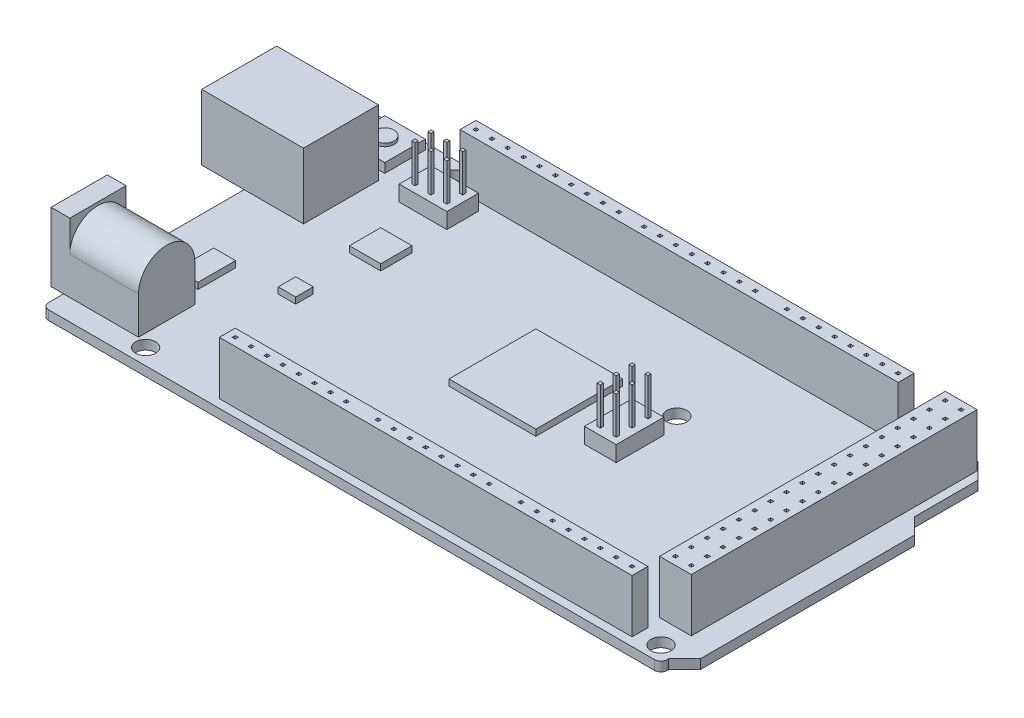
from build123d import *

# Parameters (mm, degrees)
BOSS_EXTRUDE1_DEPTH      = 1.5
FILLET1_R                = 1
SKETCH2_R                = 1.6
CUT_EXTRUDE1_DEPTH       = 59.477289609
SKETCH3_W                = 5.08
SKETCH3_H                = 45.72
BOSS_EXTRUDE2_DEPTH      = 8.5
SKETCH4_W                = 0.5
SKETCH4_H                = 0.5
CUT_EXTRUDE2_DEPTH       = 7
BOSS_EXTRUDE3_DEPTH      = 6.8
BOSS_EXTRUDE3_DEPTH_BACK = 9.5
SKETCH5_W                = 12
SKETCH5_H                = 10.5
BOSS_EXTRUDE4_DEPTH      = 2
BOSS_EXTRUDE4_DEPTH_BACK = 1
SKETCH6_W                = 9
SKETCH6_H                = 11
SKETCH7_R                = 4.5
BOSS_EXTRUDE5_DEPTH      = 11
SKETCH8_W                = 11
SKETCH8_H                = 9
BOSS_EXTRUDE6_DEPTH      = 6
CUT_EXTRUDE3_DEPTH       = 9
SKETCH10_W               = 5
SKETCH10_H               = 3.5
BOSS_EXTRUDE7_DEPTH      = 8.5
SKETCH11_W               = 13.9
SKETCH11_H               = 13.9
SKETCH11_W_2             = 5
SKETCH11_H_2             = 5
SKETCH11_W_3             = 2.8
SKETCH11_H_3             = 2.8
SKETCH11_W_4             = 3.5
SKETCH11_H_4             = 6
BOSS_EXTRUDE8_DEPTH      = 1
SKETCH12_R               = 3
CUT_EXTRUDE4_DEPTH       = 9.5
SKETCH13_R               = 1.25
BOSS_EXTRUDE9_DEPTH      = 7.5
FILLET2_R                = 1
SKETCH14_W               = 6.5
SKETCH14_H               = 6.5
BOSS_EXTRUDE10_DEPTH     = 1.5
SKETCH15_R               = 1.5
BOSS_EXTRUDE11_DEPTH     = 0.5
SKETCH16_W               = 5.08
SKETCH16_H               = 7.62
SKETCH16_W_2             = 7.62
SKETCH16_H_2             = 5.08
BOSS_EXTRUDE12_DEPTH     = 2.5
SKETCH17_W               = 0.5
SKETCH17_H               = 0.5
BOSS_EXTRUDE13_DEPTH     = 6


with BuildPart() as part:
    # Sketch1 → Boss-Extrude1 (new body)
    with BuildSketch(Plane(origin=(0, 0, 0), x_dir=(1, 0, 0), z_dir=(0, 1, 0))):
        Polygon((49.49, 24.11), (49.49, 13.95), (52.03, 11.41), (52.03, -22.85), (49.49, -25.39), (49.49, -26.65), (-49.49, -26.65), (-49.49, 26.65), (46.95, 26.65), align=None)
    extrude(amount=BOSS_EXTRUDE1_DEPTH)

    # Fillet1
    fillet1_edges = [part.edges().sort_by_distance(p)[0] for p in [
        (-49.49, 0.75, -26.65),
        (49.49, 0.75, 26.65),
        (-49.49, 0.75, 26.65),
    ]]
    fillet(fillet1_edges, radius=FILLET1_R)

    # Sketch2 → Cut-Extrude1 (cut, through all)
    with BuildSketch(Plane(origin=(0, 1.5, 0), x_dir=(1, 0, 0), z_dir=(0, 1, 0))):
        with Locations(Location((46.98, -24.11, 0), (0, 0, 270))):
            Circle(SKETCH2_R)
        with Locations(Location((40.62, 24.11, 0), (0, 0, 270))):
            Circle(SKETCH2_R)
        with Locations(Location((-34.26, 24.11, 0), (0, 0, 270))):
            Circle(SKETCH2_R)
        with Locations(Location((-35.49, -24.11, 0), (0, 0, 270))):
            Circle(SKETCH2_R)
        with Locations(Location((16.53, -19.03, 0), (0, 0, 270))):
            Circle(SKETCH2_R)
        with Locations(Location((16.53, 8.88, 0), (0, 0, 270))):
            Circle(SKETCH2_R)
    extrude(amount=-CUT_EXTRUDE1_DEPTH, mode=Mode.SUBTRACT)

    # Sketch3 → Boss-Extrude2 (add)
    with BuildSketch(Plane(origin=(0, 1.5, 0), x_dir=(1, 0, 0), z_dir=(0, 1, 0))):
        Polygon((-22.51, -22.76), (-2.19, -22.76), (0.35, -22.76), (20.67, -22.76), (23.21, -22.76), (43.53, -22.76), (43.53, -25.3), (23.21, -25.3), (20.67, -25.3), (0.35, -25.3), (-2.19, -25.3), (-22.51, -25.3), align=None)
        with Locations((45.6, 2.44)):
            Rectangle(SKETCH3_W, SKETCH3_H)
        Polygon((38.06, 25.3), (17.74, 25.3), (15.2, 25.3), (-5.12, 25.3), (-6.64, 25.3), (-32.04, 25.3), (-32.04, 22.76), (-6.64, 22.76), (-5.12, 22.76), (15.2, 22.76), (17.74, 22.76), (38.06, 22.76), align=None)
    extrude(amount=BOSS_EXTRUDE2_DEPTH)

    # Sketch4 → Cut-Extrude2 (cut)
    with BuildSketch(Plane(origin=(0, 10, 0), x_dir=(1, 0, 0), z_dir=(0, 1, 0))):
        with Locations((-21.24, -24.03)):
            Rectangle(SKETCH4_W, SKETCH4_H)
        with Locations((-18.7, -24.03)):
            Rectangle(SKETCH4_W, SKETCH4_H)
        with Locations((-16.16, -24.03)):
            Rectangle(SKETCH4_W, SKETCH4_H)
        with Locations((-13.62, -24.03)):
            Rectangle(SKETCH4_W, SKETCH4_H)
        with Locations((-11.08, -24.03)):
            Rectangle(SKETCH4_W, SKETCH4_H)
        with Locations((-8.54, -24.03)):
            Rectangle(SKETCH4_W, SKETCH4_H)
        with Locations((-6, -24.03)):
            Rectangle(SKETCH4_W, SKETCH4_H)
        with Locations((-3.46, -24.03)):
            Rectangle(SKETCH4_W, SKETCH4_H)
        with Locations((1.62, -24.03)):
            Rectangle(SKETCH4_W, SKETCH4_H)
        with Locations((4.16, -24.03)):
            Rectangle(SKETCH4_W, SKETCH4_H)
        with Locations((6.7, -24.03)):
            Rectangle(SKETCH4_W, SKETCH4_H)
        with Locations((9.24, -24.03)):
            Rectangle(SKETCH4_W, SKETCH4_H)
        with Locations((11.78, -24.03)):
            Rectangle(SKETCH4_W, SKETCH4_H)
        with Locations((14.32, -24.03)):
            Rectangle(SKETCH4_W, SKETCH4_H)
        with Locations((16.86, -24.03)):
            Rectangle(SKETCH4_W, SKETCH4_H)
        with Locations((19.4, -24.03)):
            Rectangle(SKETCH4_W, SKETCH4_H)
        with Locations((24.48, -24.03)):
            Rectangle(SKETCH4_W, SKETCH4_H)
        with Locations((27.02, -24.03)):
            Rectangle(SKETCH4_W, SKETCH4_H)
        with Locations((29.56, -24.03)):
            Rectangle(SKETCH4_W, SKETCH4_H)
        with Locations((32.1, -24.03)):
            Rectangle(SKETCH4_W, SKETCH4_H)
        with Locations((34.64, -24.03)):
            Rectangle(SKETCH4_W, SKETCH4_H)
        with Locations((37.18, -24.03)):
            Rectangle(SKETCH4_W, SKETCH4_H)
        with Locations((39.72, -24.03)):
            Rectangle(SKETCH4_W, SKETCH4_H)
        with Locations((42.26, -24.03)):
            Rectangle(SKETCH4_W, SKETCH4_H)
        with Locations((46.87, -19.15)):
            Rectangle(SKETCH4_W, SKETCH4_H)
        with Locations((44.33, -19.15)):
            Rectangle(SKETCH4_W, SKETCH4_H)
        with Locations((46.87, -16.61)):
            Rectangle(SKETCH4_W, SKETCH4_H)
        with Locations((44.33, -16.61)):
            Rectangle(SKETCH4_W, SKETCH4_H)
        with Locations((46.87, -14.07)):
            Rectangle(SKETCH4_W, SKETCH4_H)
        with Locations((44.33, -14.07)):
            Rectangle(SKETCH4_W, SKETCH4_H)
        with Locations((46.87, -11.53)):
            Rectangle(SKETCH4_W, SKETCH4_H)
        with Locations((44.33, -11.53)):
            Rectangle(SKETCH4_W, SKETCH4_H)
        with Locations((46.87, -8.99)):
            Rectangle(SKETCH4_W, SKETCH4_H)
        with Locations((44.33, -8.99)):
            Rectangle(SKETCH4_W, SKETCH4_H)
        with Locations((46.87, -6.45)):
            Rectangle(SKETCH4_W, SKETCH4_H)
        with Locations((44.33, -6.45)):
            Rectangle(SKETCH4_W, SKETCH4_H)
        with Locations((46.87, -3.91)):
            Rectangle(SKETCH4_W, SKETCH4_H)
        with Locations((44.33, -3.91)):
            Rectangle(SKETCH4_W, SKETCH4_H)
        with Locations((46.87, -1.37)):
            Rectangle(SKETCH4_W, SKETCH4_H)
        with Locations((44.33, -1.37)):
            Rectangle(SKETCH4_W, SKETCH4_H)
        with Locations((46.87, 1.17)):
            Rectangle(SKETCH4_W, SKETCH4_H)
        with Locations((44.33, 1.17)):
            Rectangle(SKETCH4_W, SKETCH4_H)
        with Locations((46.87, 3.71)):
            Rectangle(SKETCH4_W, SKETCH4_H)
        with Locations((44.33, 3.71)):
            Rectangle(SKETCH4_W, SKETCH4_H)
        with Locations((46.87, 6.25)):
            Rectangle(SKETCH4_W, SKETCH4_H)
        with Locations((44.33, 6.25)):
            Rectangle(SKETCH4_W, SKETCH4_H)
        with Locations((46.87, 8.79)):
            Rectangle(SKETCH4_W, SKETCH4_H)
        with Locations((44.33, 8.79)):
            Rectangle(SKETCH4_W, SKETCH4_H)
        with Locations((46.87, 11.33)):
            Rectangle(SKETCH4_W, SKETCH4_H)
        with Locations((44.33, 11.33)):
            Rectangle(SKETCH4_W, SKETCH4_H)
        with Locations((46.87, 13.87)):
            Rectangle(SKETCH4_W, SKETCH4_H)
        with Locations((44.33, 13.87)):
            Rectangle(SKETCH4_W, SKETCH4_H)
        with Locations((46.87, 16.41)):
            Rectangle(SKETCH4_W, SKETCH4_H)
        with Locations((44.33, 16.41)):
            Rectangle(SKETCH4_W, SKETCH4_H)
        with Locations((46.87, 18.95)):
            Rectangle(SKETCH4_W, SKETCH4_H)
        with Locations((44.33, 18.95)):
            Rectangle(SKETCH4_W, SKETCH4_H)
        with Locations((46.87, 21.49)):
            Rectangle(SKETCH4_W, SKETCH4_H)
        with Locations((44.33, 21.49)):
            Rectangle(SKETCH4_W, SKETCH4_H)
        with Locations((46.87, 24.03)):
            Rectangle(SKETCH4_W, SKETCH4_H)
        with Locations((44.33, 24.03)):
            Rectangle(SKETCH4_W, SKETCH4_H)
        with Locations((36.79, 24.03)):
            Rectangle(SKETCH4_W, SKETCH4_H)
        with Locations((34.25, 24.03)):
            Rectangle(SKETCH4_W, SKETCH4_H)
        with Locations((31.71, 24.03)):
            Rectangle(SKETCH4_W, SKETCH4_H)
        with Locations((29.17, 24.03)):
            Rectangle(SKETCH4_W, SKETCH4_H)
        with Locations((26.63, 24.03)):
            Rectangle(SKETCH4_W, SKETCH4_H)
        with Locations((24.09, 24.03)):
            Rectangle(SKETCH4_W, SKETCH4_H)
        with Locations((21.55, 24.03)):
            Rectangle(SKETCH4_W, SKETCH4_H)
        with Locations((19.01, 24.03)):
            Rectangle(SKETCH4_W, SKETCH4_H)
        with Locations((13.93, 24.03)):
            Rectangle(SKETCH4_W, SKETCH4_H)
        with Locations((11.39, 24.03)):
            Rectangle(SKETCH4_W, SKETCH4_H)
        with Locations((8.85, 24.03)):
            Rectangle(SKETCH4_W, SKETCH4_H)
        with Locations((6.31, 24.03)):
            Rectangle(SKETCH4_W, SKETCH4_H)
        with Locations((3.77, 24.03)):
            Rectangle(SKETCH4_W, SKETCH4_H)
        with Locations((1.23, 24.03)):
            Rectangle(SKETCH4_W, SKETCH4_H)
        with Locations((-1.31, 24.03)):
            Rectangle(SKETCH4_W, SKETCH4_H)
        with Locations((-3.85, 24.03)):
            Rectangle(SKETCH4_W, SKETCH4_H)
        with Locations((-7.91, 24.03)):
            Rectangle(SKETCH4_W, SKETCH4_H)
        with Locations((-10.45, 24.03)):
            Rectangle(SKETCH4_W, SKETCH4_H)
        with Locations((-12.99, 24.03)):
            Rectangle(SKETCH4_W, SKETCH4_H)
        with Locations((-15.53, 24.03)):
            Rectangle(SKETCH4_W, SKETCH4_H)
        with Locations((-18.07, 24.03)):
            Rectangle(SKETCH4_W, SKETCH4_H)
        with Locations((-20.61, 24.03)):
            Rectangle(SKETCH4_W, SKETCH4_H)
        with Locations((-23.15, 24.03)):
            Rectangle(SKETCH4_W, SKETCH4_H)
        with Locations((-25.69, 24.03)):
            Rectangle(SKETCH4_W, SKETCH4_H)
        with Locations((-28.23, 24.03)):
            Rectangle(SKETCH4_W, SKETCH4_H)
        with Locations((-30.77, 24.03)):
            Rectangle(SKETCH4_W, SKETCH4_H)
    extrude(amount=-CUT_EXTRUDE2_DEPTH, mode=Mode.SUBTRACT)

    # Sketch5 → Boss-Extrude3 (add, two sides: drawn at the far end of the back side and taken through both)
    with BuildSketch(Plane.ZY.offset(49.49).offset(-BOSS_EXTRUDE3_DEPTH_BACK)):
        with Locations((-11.65, 6.75)):
            Rectangle(SKETCH5_W, SKETCH5_H)
    extrude(amount=BOSS_EXTRUDE3_DEPTH + BOSS_EXTRUDE3_DEPTH_BACK)



with BuildPart() as body_2:
    # Sketch6 → Boss-Extrude4 (new, two sides: drawn at the far end of the back side and taken through both)
    with BuildSketch(Plane.ZY.offset(49.49).offset(-BOSS_EXTRUDE4_DEPTH_BACK)):
        with Locations((18.75, 7)):
            Rectangle(SKETCH6_W, SKETCH6_H)
    extrude(amount=BOSS_EXTRUDE4_DEPTH + BOSS_EXTRUDE4_DEPTH_BACK)


with BuildPart() as part_1:
    add(part.part)

    add(body_2.part)  # Boss-Extrude5 merges body 2
    # Sketch7 → Boss-Extrude5 (add)
    with BuildSketch(Plane(origin=(-48.49, 0, 0), x_dir=(0, 0, -1), z_dir=(1, 0, 0))):
        with Locations((-18.75, 7.5)):
            Circle(SKETCH7_R)
    extrude(amount=BOSS_EXTRUDE5_DEPTH)

    # Sketch8 → Boss-Extrude6 (add)
    with BuildSketch(Plane(origin=(0, 1.5, 0), x_dir=(1, 0, 0), z_dir=(0, 1, 0))):
        with Locations((-42.99, -18.75)):
            Rectangle(SKETCH8_W, SKETCH8_H)
    extrude(amount=BOSS_EXTRUDE6_DEPTH)

    # Sketch9 → Cut-Extrude3 (cut)
    with BuildSketch(Plane.ZY.offset(56.29)):
        Polygon((-14.15, 10.5), (-9.15, 10.5), (-7.65, 9), (-7.65, 2.5), (-15.65, 2.5), (-15.65, 9), align=None)
    extrude(amount=-CUT_EXTRUDE3_DEPTH, mode=Mode.SUBTRACT)

    # Sketch10 → Boss-Extrude7 (add)
    with BuildSketch(Plane.ZY.offset(47.29)):
        with Locations((-11.65, 6.5)):
            Rectangle(SKETCH10_W, SKETCH10_H)
    extrude(amount=BOSS_EXTRUDE7_DEPTH)

    # Sketch11 → Boss-Extrude8 (add)
    with BuildSketch(Plane(origin=(0, 1.5, 0), x_dir=(1, 0, 0), z_dir=(0, 1, 0))):
        with Locations((1.09, 1.75)):
            Rectangle(SKETCH11_W, SKETCH11_H)
        with Locations((-29.79, 7.8)):
            Rectangle(SKETCH11_W_2, SKETCH11_H_2)
        with Locations((-30.89, -4.7)):
            Rectangle(SKETCH11_W_3, SKETCH11_H_3)
        with Locations((-41.090307387, -8.878300353)):
            Rectangle(SKETCH11_W_4, SKETCH11_H_4)
    extrude(amount=BOSS_EXTRUDE8_DEPTH)

    # Sketch12 → Cut-Extrude4 (cut)
    with BuildSketch(Plane.ZY.offset(51.49)):
        with Locations((18.75, 8)):
            Circle(SKETCH12_R)
    extrude(amount=-CUT_EXTRUDE4_DEPTH, mode=Mode.SUBTRACT)

    # Sketch13 → Boss-Extrude9 (add)
    with BuildSketch(Plane.ZY.offset(41.99)):
        with Locations((18.75, 8)):
            Circle(SKETCH13_R)
    extrude(amount=BOSS_EXTRUDE9_DEPTH)

    # Fillet2
    fillet2_edges = [part_1.edges().sort_by_distance(p)[0] for p in [
        (-49.49, 8, 17.5),
    ]]
    fillet(fillet2_edges, radius=FILLET2_R)

    # Sketch14 → Boss-Extrude10 (add)
    with BuildSketch(Plane(origin=(0, 1.5, 0), x_dir=(1, 0, 0), z_dir=(0, 1, 0))):
        with Locations((-43.74, 22.4)):
            Rectangle(SKETCH14_W, SKETCH14_H)
    extrude(amount=BOSS_EXTRUDE10_DEPTH)

    # Sketch15 → Boss-Extrude11 (add)
    with BuildSketch(Plane(origin=(0, 3, 0), x_dir=(1, 0, 0), z_dir=(0, 1, 0))):
        with Locations(Location((-43.74, 22.4, 0), (0, 0, 270))):
            Circle(SKETCH15_R)
    extrude(amount=BOSS_EXTRUDE11_DEPTH)

    # Sketch16 → Boss-Extrude12 (add)
    with BuildSketch(Plane(origin=(0, 1.5, 0), x_dir=(1, 0, 0), z_dir=(0, 1, 0))):
        with Locations((15.58, 1.39)):
            Rectangle(SKETCH16_W, SKETCH16_H)
        with Locations((-31.55, 18.87)):
            Rectangle(SKETCH16_W_2, SKETCH16_H_2)
    extrude(amount=BOSS_EXTRUDE12_DEPTH)

    # Sketch17 → Boss-Extrude13 (add)
    with BuildSketch(Plane(origin=(0, 4, 0), x_dir=(1, 0, 0), z_dir=(0, 1, 0))):
        with Locations((-34.09, 17.6)):
            Rectangle(SKETCH17_W, SKETCH17_H)
        with Locations((-34.09, 20.14)):
            Rectangle(SKETCH17_W, SKETCH17_H)
        with Locations((16.85, -1.15)):
            Rectangle(SKETCH17_W, SKETCH17_H)
        with Locations((14.31, -1.15)):
            Rectangle(SKETCH17_W, SKETCH17_H)
        with Locations((-31.55, 20.14)):
            Rectangle(SKETCH17_W, SKETCH17_H)
        with Locations((-31.55, 17.6)):
            Rectangle(SKETCH17_W, SKETCH17_H)
        with Locations((-29.01, 20.14)):
            Rectangle(SKETCH17_W, SKETCH17_H)
        with Locations((-29.01, 17.6)):
            Rectangle(SKETCH17_W, SKETCH17_H)
        with Locations((14.31, 1.39)):
            Rectangle(SKETCH17_W, SKETCH17_H)
        with Locations((16.85, 1.39)):
            Rectangle(SKETCH17_W, SKETCH17_H)
        with Locations((14.31, 3.93)):
            Rectangle(SKETCH17_W, SKETCH17_H)
        with Locations((16.85, 3.93)):
            Rectangle(SKETCH17_W, SKETCH17_H)
    extrude(amount=BOSS_EXTRUDE13_DEPTH)


solid = part_1.part
